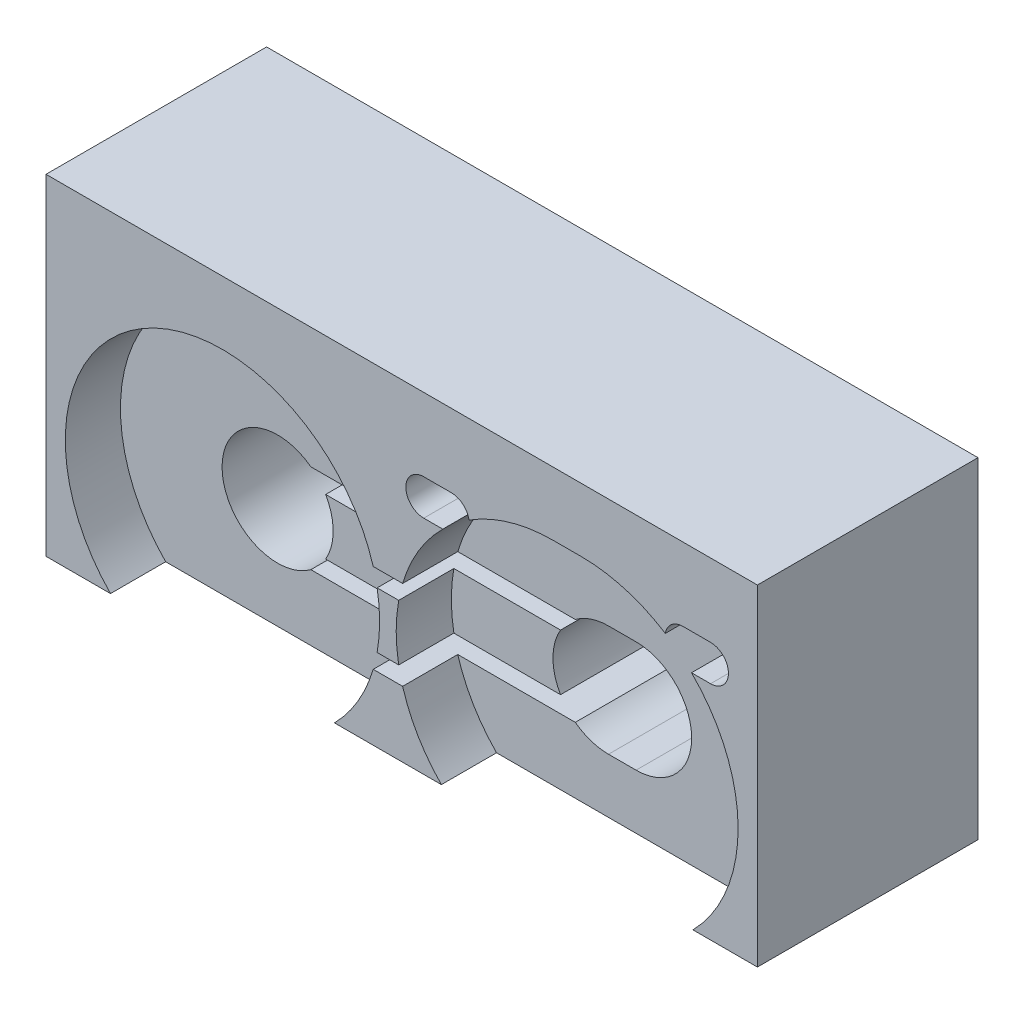
from build123d import *

# Parameters (mm, degrees)
SKETCH1_W                          = 200
SKETCH1_H                          = 90
BOSS_EXTRUDE1_DEPTH                = 40
SHAFTFITS_WITH_5MM_TOLERANCE_REACH = 120.743
SKETCH2_R                          = 3
SHAFTFITTOLERANCE_DEPTH            = 40
SKETCH3_R                          = 8.075
PULLEY_DEPTH                       = 30
SKETCH4_R                          = 26.5
GEARS_FITS_DEPTH                   = 10
GEAR_LETOUT_REACH                  = 120.743
SKETCH5_W                          = 200
SKETCH5_H                          = 30
CLOSED_LOOP_TIMING_BELT_REACH      = 116.891
SKETCH8_W                          = 60
SKETCH8_H                          = 3
SKETCH7_R                          = 10.075
PULLEY_MARGIN_DEPTH                = 20
SKETCH6_R                          = 28.5
GEAR_MARGIN_DEPTH                  = 10
PULLEYFIXTOLERANCE_DEPTH           = 30
GEARFITSTOLERANCE_DEPTH            = 10
M3_SCREWHOLES_REACH                = 116.891
M3_SCREWHEADS_DEPTH                = 5
M3_SCREWHEADS_DIRECTION_2_REACH    = 113.803
SKETCH16_W                         = 33
SKETCH16_H                         = 60
REMOVEEXTRA1_DEPTH                 = 40
SKETCH17_W                         = 5
SKETCH17_H                         = 60
REMOVEEXTRA2_DEPTH                 = 40


with BuildPart() as part:
    # Sketch1 → Boss-Extrude1 (new body)
    with BuildSketch(Plane.XY):
        with Locations((0, -5)):
            Rectangle(SKETCH1_W, SKETCH1_H)
    extrude(amount=BOSS_EXTRUDE1_DEPTH)

    # Sketch2 → ShaftFits_with.5mm_tolerance (cut, up to next)
    with BuildSketch(Plane.XY.offset(40), mode=Mode.PRIVATE) as shaftfits_with_5mm_tolerance_sk1:
        with Locations((30, 0)):
            Circle(SKETCH2_R)
    shaftfits_with_5mm_tolerance_tool1 = extrude(shaftfits_with_5mm_tolerance_sk1.sketch, amount=-SHAFTFITS_WITH_5MM_TOLERANCE_REACH, mode=Mode.PRIVATE) & part.part
    # Sketch2 → ShaftFits_with.5mm_tolerance (cut, up to next)
    with BuildSketch(Plane.XY.offset(40), mode=Mode.PRIVATE) as shaftfits_with_5mm_tolerance_sk2:
        with Locations(Location((-30, 0, 0), (0, 0, 180))):
            Circle(SKETCH2_R)
    shaftfits_with_5mm_tolerance_tool2 = extrude(shaftfits_with_5mm_tolerance_sk2.sketch, amount=-SHAFTFITS_WITH_5MM_TOLERANCE_REACH, mode=Mode.PRIVATE) & part.part
    add(shaftfits_with_5mm_tolerance_tool1.solids().sort_by_distance((30, 0, 40))[0], mode=Mode.SUBTRACT)
    add(shaftfits_with_5mm_tolerance_tool2.solids().sort_by_distance((-30, 0, 40))[0], mode=Mode.SUBTRACT)

    # Sketch9 → ShaftFitTolerance (cut)
    with BuildSketch(Plane.XY.offset(40)):
        with BuildLine():
            Line((30, 3), (35, 3))
            ThreePointArc((35, 3), (38, 0), (35, -3))
            Line((35, -3), (30, -3))
            ThreePointArc((30, -3), (27, 0), (30, 3))
        make_face()
    extrude(amount=-SHAFTFITTOLERANCE_DEPTH, mode=Mode.SUBTRACT)

    # Sketch3 → Pulley (cut)
    with BuildSketch(Plane.XY.offset(40)):
        with Locations((30, 0)):
            Circle(SKETCH3_R)
        with Locations(Location((-30, 0, 0), (0, 0, 180))):
            Circle(SKETCH3_R)
    extrude(amount=-PULLEY_DEPTH, mode=Mode.SUBTRACT)

    # Sketch4 → Gears fits (cut)
    with BuildSketch(Plane.XY.offset(40)):
        with Locations((30, 0)):
            Circle(SKETCH4_R)
        with Locations(Location((-30, 0, 0), (0, 0, 180))):
            Circle(SKETCH4_R)
    extrude(amount=-GEARS_FITS_DEPTH, mode=Mode.SUBTRACT)

    # Sketch5 → Gear letout (cut, up to next)
    with BuildSketch(Plane.XY.offset(40), mode=Mode.PRIVATE) as gear_letout_sk1:
        with Locations((0, -35)):
            Rectangle(SKETCH5_W, SKETCH5_H)
    gear_letout_tool1 = extrude(gear_letout_sk1.sketch, amount=-GEAR_LETOUT_REACH, mode=Mode.PRIVATE) & part.part
    add(gear_letout_tool1.solids().sort_by_distance((0, -35, 40))[0], mode=Mode.SUBTRACT)

    # Closed-loop timing belt: up to this face of the body (flat: up to its plane)
    closed_loop_timing_belt_end = Plane(part.part.faces().sort_by_distance((-22.15339549, 0, 10))[0])
    # Sketch8 → Closed-loop timing belt (cut, up to the picked face)
    with BuildSketch(Plane.XY.offset(40), mode=Mode.PRIVATE) as closed_loop_timing_belt_sk1:
        with Locations((0, 6.575)):
            Rectangle(SKETCH8_W, SKETCH8_H)
    closed_loop_timing_belt_tool1 = split(extrude(closed_loop_timing_belt_sk1.sketch, amount=-CLOSED_LOOP_TIMING_BELT_REACH, mode=Mode.PRIVATE), bisect_by=closed_loop_timing_belt_end, keep=Keep.BOTH, mode=Mode.PRIVATE)
    # Sketch8 → Closed-loop timing belt (cut, up to the picked face)
    with BuildSketch(Plane.XY.offset(40), mode=Mode.PRIVATE) as closed_loop_timing_belt_sk2:
        with Locations((0, -6.575)):
            Rectangle(SKETCH8_W, SKETCH8_H)
    closed_loop_timing_belt_tool2 = split(extrude(closed_loop_timing_belt_sk2.sketch, amount=-CLOSED_LOOP_TIMING_BELT_REACH, mode=Mode.PRIVATE), bisect_by=closed_loop_timing_belt_end, keep=Keep.BOTH, mode=Mode.PRIVATE)
    add(closed_loop_timing_belt_tool1.solids().sort_by(Axis((0, 6.575, 40), (0, 0, -1)))[0], mode=Mode.SUBTRACT)
    add(closed_loop_timing_belt_tool2.solids().sort_by(Axis((0, -6.575, 40), (0, 0, -1)))[0], mode=Mode.SUBTRACT)

    # Sketch7 → Pulley margin (cut)
    with BuildSketch(Plane.XY.offset(30)):
        with Locations((30, 0)):
            Circle(SKETCH7_R)
        with Locations((-30, 0)):
            Circle(SKETCH7_R)
    extrude(amount=-PULLEY_MARGIN_DEPTH, mode=Mode.SUBTRACT)

    # Sketch6 → Gear margin (cut)
    with BuildSketch(Plane.XY.offset(40)):
        with Locations((30, 0)):
            Circle(SKETCH6_R)
        with Locations((-30, 0)):
            Circle(SKETCH6_R)
    extrude(amount=-GEAR_MARGIN_DEPTH, mode=Mode.SUBTRACT)

    # Sketch12 → PulleyFixTolerance (cut)
    with BuildSketch(Plane.XY.offset(40)):
        with BuildLine():
            Line((30, 10.075), (35, 10.075))
            ThreePointArc((35, 10.075), (45.075, 0), (35, -10.075))
            Line((35, -10.075), (30, -10.075))
            ThreePointArc((30, -10.075), (19.925, 0), (30, 10.075))
        make_face()
    extrude(amount=-PULLEYFIXTOLERANCE_DEPTH, mode=Mode.SUBTRACT)

    # Sketch13 → GearFitsTolerance (cut)
    with BuildSketch(Plane.XY.offset(40)):
        with BuildLine():
            Line((30, 28.5), (35, 28.5))
            ThreePointArc((35, 28.5), (63.5, 0), (35, -28.5))
            Line((35, -28.5), (30, -28.5))
            ThreePointArc((30, -28.5), (1.5, 0), (30, 28.5))
        make_face()
    extrude(amount=-GEARFITSTOLERANCE_DEPTH, mode=Mode.SUBTRACT)

    # M3 ScrewHoles: up to this face of the body (flat: up to its plane)
    m3_screwholes_end = Plane(part.part.faces().sort_by_distance((0, -15.281996404, 40))[0])
    # Sketch14 → M3 ScrewHoles (cut, up to the picked face)
    with BuildSketch(Plane(origin=(0, 0, 0), x_dir=(-1, 0, 0), z_dir=(0, 0, -1)), mode=Mode.PRIVATE) as m3_screwholes_sk1:
        with BuildLine():
            Line((-6.5, 21.75), (-11.5, 21.75))
            ThreePointArc((-11.5, 21.75), (-13.25, 23.5), (-11.5, 25.25))
            Line((-11.5, 25.25), (-6.5, 25.25))
            ThreePointArc((-6.5, 25.25), (-4.75, 23.5), (-6.5, 21.75))
        make_face()
    m3_screwholes_tool1 = split(extrude(m3_screwholes_sk1.sketch, amount=-M3_SCREWHOLES_REACH, mode=Mode.PRIVATE), bisect_by=m3_screwholes_end, keep=Keep.BOTH, mode=Mode.PRIVATE)
    # Sketch14 → M3 ScrewHoles (cut, up to the picked face)
    with BuildSketch(Plane(origin=(0, 0, 0), x_dir=(-1, 0, 0), z_dir=(0, 0, -1)), mode=Mode.PRIVATE) as m3_screwholes_sk2:
        with BuildLine():
            Line((-53.5, 21.75), (-58.5, 21.75))
            ThreePointArc((-58.5, 21.75), (-60.25, 23.5), (-58.5, 25.25))
            Line((-58.5, 25.25), (-53.5, 25.25))
            ThreePointArc((-53.5, 25.25), (-51.75, 23.5), (-53.5, 21.75))
        make_face()
    m3_screwholes_tool2 = split(extrude(m3_screwholes_sk2.sketch, amount=-M3_SCREWHOLES_REACH, mode=Mode.PRIVATE), bisect_by=m3_screwholes_end, keep=Keep.BOTH, mode=Mode.PRIVATE)
    # Sketch14 → M3 ScrewHoles (cut, up to the picked face)
    with BuildSketch(Plane(origin=(0, 0, 0), x_dir=(-1, 0, 0), z_dir=(0, 0, -1)), mode=Mode.PRIVATE) as m3_screwholes_sk3:
        with BuildLine():
            Line((-53.5, -21.75), (-58.5, -21.75))
            ThreePointArc((-58.5, -21.75), (-60.25, -23.5), (-58.5, -25.25))
            Line((-58.5, -25.25), (-53.5, -25.25))
            ThreePointArc((-53.5, -25.25), (-51.75, -23.5), (-53.5, -21.75))
        make_face()
    m3_screwholes_tool3 = split(extrude(m3_screwholes_sk3.sketch, amount=-M3_SCREWHOLES_REACH, mode=Mode.PRIVATE), bisect_by=m3_screwholes_end, keep=Keep.BOTH, mode=Mode.PRIVATE)
    # Sketch14 → M3 ScrewHoles (cut, up to the picked face)
    with BuildSketch(Plane(origin=(0, 0, 0), x_dir=(-1, 0, 0), z_dir=(0, 0, -1)), mode=Mode.PRIVATE) as m3_screwholes_sk4:
        with BuildLine():
            Line((-6.5, -21.75), (-11.5, -21.75))
            ThreePointArc((-11.5, -21.75), (-13.25, -23.5), (-11.5, -25.25))
            Line((-11.5, -25.25), (-6.5, -25.25))
            ThreePointArc((-6.5, -25.25), (-4.75, -23.5), (-6.5, -21.75))
        make_face()
    m3_screwholes_tool4 = split(extrude(m3_screwholes_sk4.sketch, amount=-M3_SCREWHOLES_REACH, mode=Mode.PRIVATE), bisect_by=m3_screwholes_end, keep=Keep.BOTH, mode=Mode.PRIVATE)
    add(m3_screwholes_tool1.solids().sort_by(Axis((9, 23.5, 0), (0, 0, 1)))[0], mode=Mode.SUBTRACT)
    add(m3_screwholes_tool2.solids().sort_by(Axis((56, 23.5, 0), (0, 0, 1)))[0], mode=Mode.SUBTRACT)
    add(m3_screwholes_tool3.solids().sort_by(Axis((56, -23.5, 0), (0, 0, 1)))[0], mode=Mode.SUBTRACT)
    add(m3_screwholes_tool4.solids().sort_by(Axis((9, -23.5, 0), (0, 0, 1)))[0], mode=Mode.SUBTRACT)

    # Sketch15 → M3 ScrewHeads (cut)
    with BuildSketch(Plane.XY.offset(30)):
        with BuildLine():
            Line((6.5, 26.75), (11.5, 26.75))
            ThreePointArc((11.5, 26.75), (14.75, 23.5), (11.5, 20.25))
            Line((11.5, 20.25), (6.5, 20.25))
            ThreePointArc((6.5, 20.25), (3.25, 23.5), (6.5, 26.75))
        make_face()
        with BuildLine():
            Line((53.5, 26.75), (58.5, 26.75))
            ThreePointArc((58.5, 26.75), (61.75, 23.5), (58.5, 20.25))
            Line((58.5, 20.25), (53.5, 20.25))
            ThreePointArc((53.5, 20.25), (50.25, 23.5), (53.5, 26.75))
        make_face()
    extrude(amount=-M3_SCREWHEADS_DEPTH, mode=Mode.SUBTRACT)

    # M3 ScrewHeads direction 2: up to this face of the body (flat: up to its plane)
    m3_screwheads_direction_2_end = Plane(part.part.faces().sort_by_distance((0, -15.281996404, 40))[0])
    # Sketch15 → M3 ScrewHeads direction 2 (cut, up to the picked face)
    with BuildSketch(Plane.XY.offset(30), mode=Mode.PRIVATE) as m3_screwheads_direction_2_sk1:
        with BuildLine():
            Line((6.5, 26.75), (11.5, 26.75))
            ThreePointArc((11.5, 26.75), (14.75, 23.5), (11.5, 20.25))
            Line((11.5, 20.25), (6.5, 20.25))
            ThreePointArc((6.5, 20.25), (3.25, 23.5), (6.5, 26.75))
        make_face()
    m3_screwheads_direction_2_tool1 = split(extrude(m3_screwheads_direction_2_sk1.sketch, amount=M3_SCREWHEADS_DIRECTION_2_REACH, mode=Mode.PRIVATE), bisect_by=m3_screwheads_direction_2_end, keep=Keep.BOTH, mode=Mode.PRIVATE)
    # Sketch15 → M3 ScrewHeads direction 2 (cut, up to the picked face)
    with BuildSketch(Plane.XY.offset(30), mode=Mode.PRIVATE) as m3_screwheads_direction_2_sk2:
        with BuildLine():
            Line((53.5, 26.75), (58.5, 26.75))
            ThreePointArc((58.5, 26.75), (61.75, 23.5), (58.5, 20.25))
            Line((58.5, 20.25), (53.5, 20.25))
            ThreePointArc((53.5, 20.25), (50.25, 23.5), (53.5, 26.75))
        make_face()
    m3_screwheads_direction_2_tool2 = split(extrude(m3_screwheads_direction_2_sk2.sketch, amount=M3_SCREWHEADS_DIRECTION_2_REACH, mode=Mode.PRIVATE), bisect_by=m3_screwheads_direction_2_end, keep=Keep.BOTH, mode=Mode.PRIVATE)
    add(m3_screwheads_direction_2_tool1.solids().sort_by(Axis((9, 23.5, 30), (0, 0, 1)))[0], mode=Mode.SUBTRACT)
    add(m3_screwheads_direction_2_tool2.solids().sort_by(Axis((56, 23.5, 30), (0, 0, 1)))[0], mode=Mode.SUBTRACT)

    # Sketch16 → RemoveExtra1 (cut)
    with BuildSketch(Plane.XY.offset(40)):
        with Locations((-83.5, 10)):
            Rectangle(SKETCH16_W, SKETCH16_H)
        with Locations((83.5, 10)):
            Rectangle(SKETCH16_W, SKETCH16_H)
    extrude(amount=-REMOVEEXTRA1_DEPTH, mode=Mode.SUBTRACT)

    # Sketch17 → RemoveExtra2 (cut)
    with BuildSketch(Plane.XY.offset(40)):
        with Locations((-64.5, 10)):
            Rectangle(SKETCH17_W, SKETCH17_H)
    extrude(amount=-REMOVEEXTRA2_DEPTH, mode=Mode.SUBTRACT)


solid = part.part
